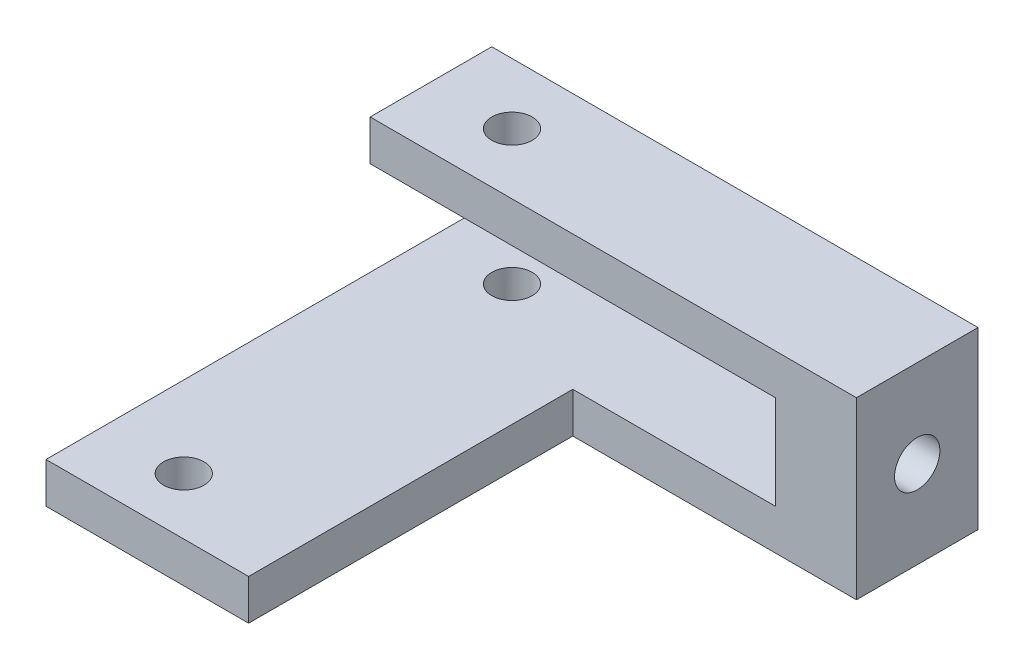
from build123d import *

# Parameters (mm, degrees)
BOSS_EXTRUDE1_DEPTH     = 19.05
SKETCH2_W               = 31.75
SKETCH2_H               = 6.35
BOSS_EXTRUDE2_DEPTH     = 50.8
CUT_EXTRUDE1_DEPTH      = 106.498403893
CUT_EXTRUDE1_DEPTH_BACK = 106.498403893
SKETCH3_R               = 3.175
SKETCH4_R               = 3.556
CUT_EXTRUDE2_DEPTH      = 50.8


with BuildPart() as part:
    # Sketch1 → Boss-Extrude1 (new body)
    with BuildSketch(Plane.XY):
        Polygon((0, 0), (76.2, 0), (76.2, -6.35), (12.7, -6.35), (12.7, -21.082), (76.2, -21.082), (76.2, -27.432), (0, -27.432), align=None)
    extrude(amount=BOSS_EXTRUDE1_DEPTH)

    # Sketch2 → Boss-Extrude2 (add)
    with BuildSketch(Plane.XY.offset(19.05)):
        with Locations((60.325, -24.257)):
            Rectangle(SKETCH2_W, SKETCH2_H)
    extrude(amount=BOSS_EXTRUDE2_DEPTH)

    # Sketch3 → Cut-Extrude1 (cut, two sides: drawn at the far end of the back side and taken through both)
    with BuildSketch(Plane(origin=(0, -21.082, 0), x_dir=(1, 0, 0), z_dir=(0, 1, 0)).offset(-CUT_EXTRUDE1_DEPTH_BACK)):
        with Locations(Location((63.5, -60.96, 0), (0, 0, 270))):
            Circle(SKETCH3_R)
        with Locations(Location((63.5, -9.525, 0), (0, 0, 270))):
            Circle(SKETCH3_R)
    extrude(amount=CUT_EXTRUDE1_DEPTH + CUT_EXTRUDE1_DEPTH_BACK, mode=Mode.SUBTRACT)

    # Sketch4 → Cut-Extrude2 (cut)
    with BuildSketch(Plane.ZY):
        with Locations((9.525, -13.716)):
            Circle(SKETCH4_R)
    extrude(amount=-CUT_EXTRUDE2_DEPTH, mode=Mode.SUBTRACT)


with BuildPart() as body_2:
    # Mirror4: mirrored copy
    add(part.part.mirror(Plane(origin=(0, 0, 19.05), x_dir=(0, 0, 1), z_dir=(1, 0, 0))))


solid = body_2.part
